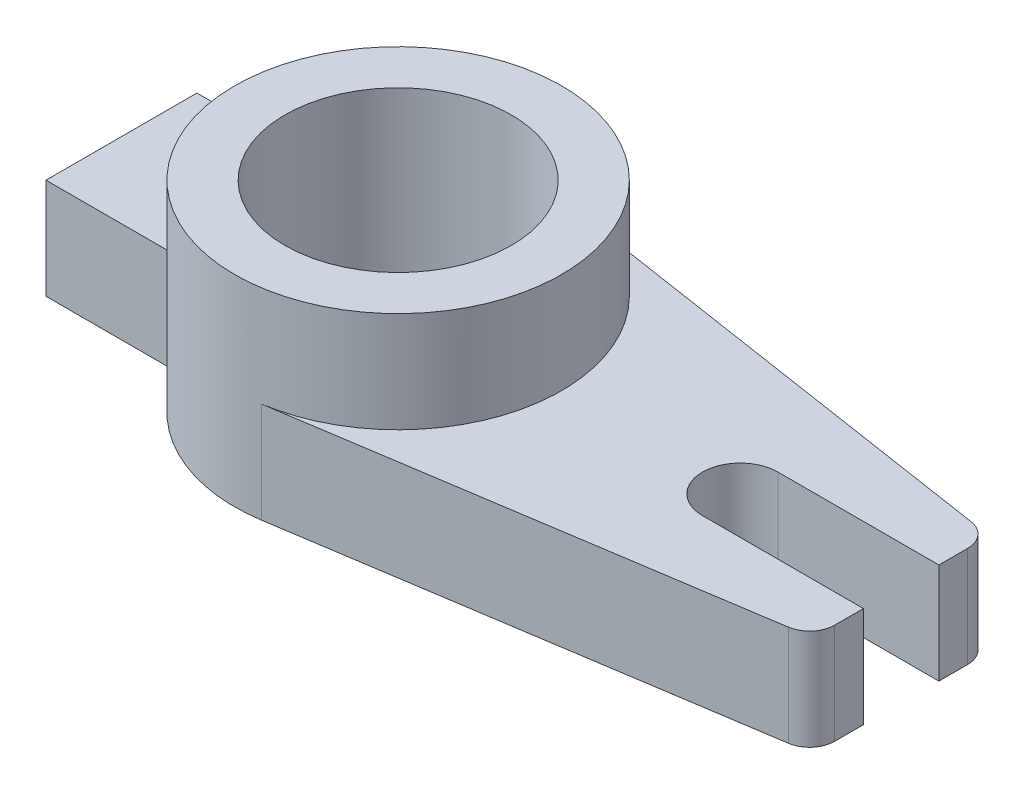
from build123d import *

# Parameters (mm, degrees)
BOSS_EXTRUDE1_DEPTH   = 20
BOSS_EXTRUDE1_2_DEPTH = 20
SKETCH2_3_R           = 32.5
SKETCH2_3_R_2         = 22.5
BOSS_EXTRUDE2_DEPTH   = 40


with BuildPart() as part:
    # Sketch2 → Boss-Extrude1 (new body)
    with BuildSketch(Plane(origin=(0, 0, 0), x_dir=(1, 0, 0), z_dir=(0, 1, 0))):
        with BuildLine():
            ThreePointArc((4.941115981, 32.122194397), (32.5, 0), (4.941115981, -32.122194397))
            Line((4.941115981, -32.122194397), (95.760171689, -18.152180955))
            ThreePointArc((95.760171689, -18.152180955), (98.794789747, -16.466003095), (100, -13.210304894))
            Line((100, -13.210304894), (100, -7.5))
            Line((100, -7.5), (68, -7.5))
            ThreePointArc((68, -7.5), (60.5, 0), (68, 7.5))
            Line((68, 7.5), (100, 7.5))
            Line((100, 7.5), (100, 13.210304894))
            ThreePointArc((100, 13.210304894), (98.794789747, 16.466003095), (95.760171689, 18.152180955))
            Line((95.760171689, 18.152180955), (4.941115981, 32.122194397))
        make_face()
    extrude(amount=BOSS_EXTRUDE1_DEPTH)



with BuildPart() as body_2:
    # Sketch2 → Boss-Extrude1 2 (new body)
    with BuildSketch(Plane(origin=(0, 0, 0), x_dir=(1, 0, 0), z_dir=(0, 1, 0))):
        with BuildLine():
            ThreePointArc((-28.831406487, -15), (-32.5, 0), (-28.831406487, 15))
            Line((-28.831406487, 15), (-55, 15))
            Line((-55, 15), (-55, -15))
            Line((-55, -15), (-28.831406487, -15))
        make_face()
    extrude(amount=BOSS_EXTRUDE1_2_DEPTH)


with BuildPart() as part_1:
    add(part.part)

    add(body_2.part)  # Boss-Extrude2 merges body 2
    # Sketch2<3> → Boss-Extrude2 (add)
    with BuildSketch(Plane(origin=(0, 0, 0), x_dir=(1, 0, 0), z_dir=(0, 1, 0))):
        Circle(SKETCH2_3_R)
        Circle(SKETCH2_3_R_2, mode=Mode.SUBTRACT)
    extrude(amount=BOSS_EXTRUDE2_DEPTH)


solid = part_1.part
